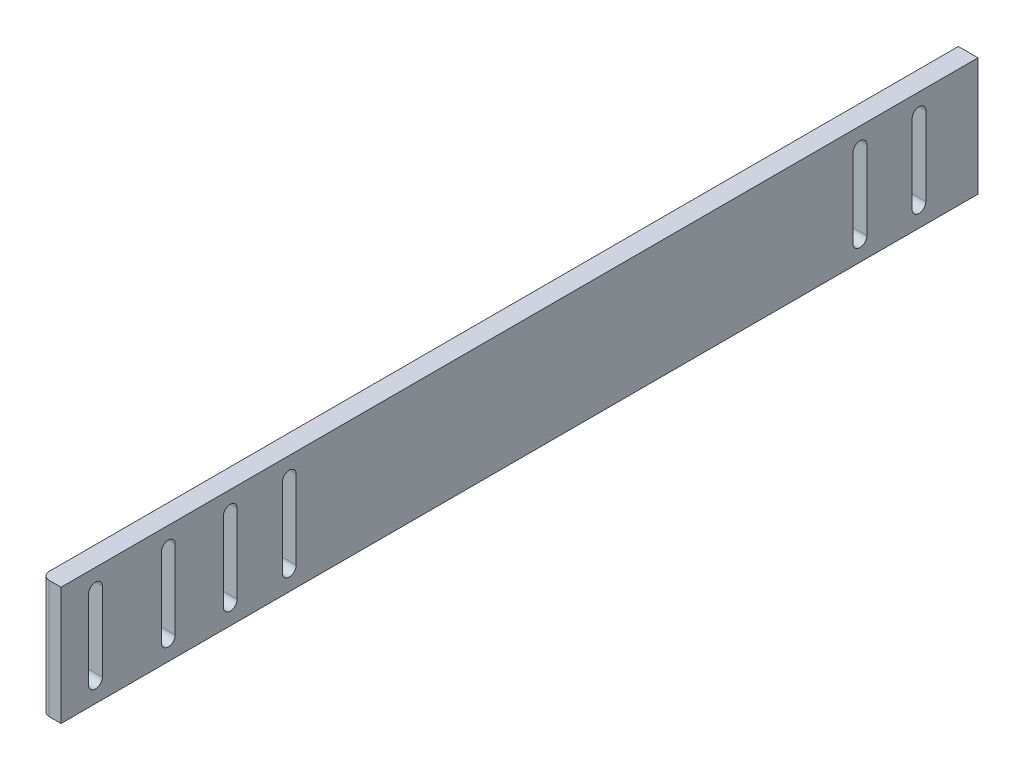
from build123d import *

# Parameters (mm, degrees)
SKETCH_1_W      = 11.5
SKETCH_1_H      = 30
SKETCH_1_W_2    = 3
SKETCH_1_W_3    = 18.5
SKETCH_1_W_4    = 200
EXTRUDE_3_DEPTH = 5
FILLET_2_R      = 2


with BuildPart() as part:
    # 草图1 → 凸台-拉伸3 (new body)
    # profile 1 of 4: a face of its own
    with BuildSketch(Plane(origin=(0, 0, 0), x_dir=(0, 0, -1), z_dir=(1, 0, 0))):
        Rectangle(SKETCH_1_W, SKETCH_1_H)
        with BuildLine():
            Line((-1.75, -10), (-1.75, 10))
            ThreePointArc((-1.75, 10), (0, 11.75), (1.75, 10))
            Line((1.75, 10), (1.75, -10))
            ThreePointArc((1.75, -10), (0, -11.75), (-1.75, -10))
        make_face(mode=Mode.SUBTRACT)
    # profile 2 of 4: a face of its own
    with BuildSketch(Plane(origin=(0, 0, 0), x_dir=(0, 0, -1), z_dir=(1, 0, 0))):
        with Locations((-7.25, 0)):
            Rectangle(SKETCH_1_W_2, SKETCH_1_H)
    # profile 3 of 4: a face of its own
    with BuildSketch(Plane(origin=(0, 0, 0), x_dir=(0, 0, -1), z_dir=(1, 0, 0))):
        with Locations((15, 0)):
            Rectangle(SKETCH_1_W_3, SKETCH_1_H)
        with BuildLine():
            ThreePointArc((20.25, -10), (18.5, -11.75), (16.75, -10))
            Line((16.75, -10), (16.75, 10))
            ThreePointArc((16.75, 10), (18.5, 11.75), (20.25, 10))
            Line((20.25, 10), (20.25, -10))
        make_face(mode=Mode.SUBTRACT)
    # profile 4 of 4: a face of its own
    with BuildSketch(Plane(origin=(0, 0, 0), x_dir=(0, 0, -1), z_dir=(1, 0, 0))):
        with Locations((124.25, 0)):
            Rectangle(SKETCH_1_W_4, SKETCH_1_H)
        with BuildLine():
            ThreePointArc((36, -10), (34.25, -11.75), (32.5, -10))
            Line((32.5, -10), (32.5, 10))
            ThreePointArc((32.5, 10), (34.25, 11.75), (36, 10))
            Line((36, 10), (36, -10))
        make_face(mode=Mode.SUBTRACT)
        with BuildLine():
            ThreePointArc((51, -10), (49.25, -11.75), (47.5, -10))
            Line((47.5, -10), (47.5, 10))
            ThreePointArc((47.5, 10), (49.25, 11.75), (51, 10))
            Line((51, 10), (51, -10))
        make_face(mode=Mode.SUBTRACT)
        with BuildLine():
            ThreePointArc((196, -10), (194.25, -11.75), (192.5, -10))
            Line((192.5, -10), (192.5, 10))
            ThreePointArc((192.5, 10), (194.25, 11.75), (196, 10))
            Line((196, 10), (196, -10))
        make_face(mode=Mode.SUBTRACT)
        with BuildLine():
            ThreePointArc((207.5, 10), (209.25, 11.75), (211, 10))
            Line((211, 10), (211, -10))
            ThreePointArc((211, -10), (209.25, -11.75), (207.5, -10))
            Line((207.5, -10), (207.5, 10))
        make_face(mode=Mode.SUBTRACT)
    extrude(amount=EXTRUDE_3_DEPTH)

    # 圆角2
    fillet_2_edges = [part.edges().sort_by_distance(p)[0] for p in [
        (0, 0, 8.75),
    ]]
    fillet(fillet_2_edges, radius=FILLET_2_R)


solid = part.part
